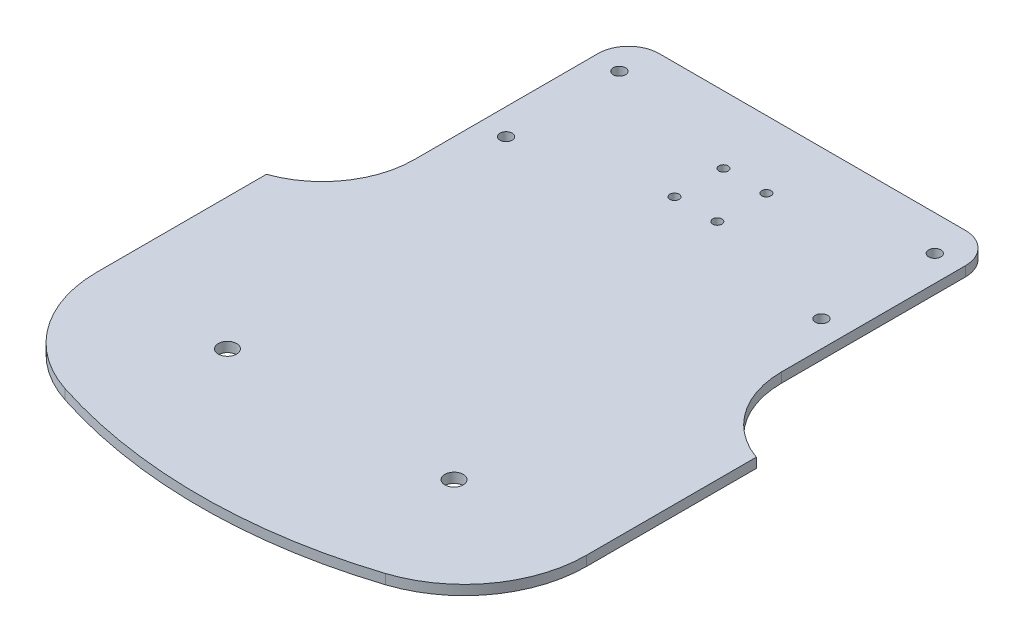
from build123d import *

# Parameters (mm, degrees)
P_IDAT_VYSUNUT_M1_DEPTH  = 0.8
SKICA2_R                 = 1
ODEBRAT_VYSUNUT_M1_DEPTH = 94.955095657
SKICA3_R                 = 0.75
ODEBRAT_VYSUNUT_M2_DEPTH = 94.955095657
SKICA8_R                 = 1.5
ODEBRAT_VYSUNUT_M4_DEPTH = 94.955095657


with BuildPart() as part:
    # Skica1 → Přidat vysunutím1 (new, symmetric)
    with BuildSketch(Plane(origin=(0, 0, 0), x_dir=(1, 0, 0), z_dir=(0, 1, 0))):
        with BuildLine():
            Line((-25, 15), (25, 15))
            ThreePointArc((25, 15), (28.535533906, 13.535533906), (30, 10))
            Line((30, 10), (30, -20))
            ThreePointArc((30, -20), (32.752551286, -28.660254038), (40, -34.142135624))
            Line((40, -34.142135624), (40, -61.846584384))
            ThreePointArc((40, -61.846584384), (36.172150801, -73.613552493), (26.153846154, -80.876302656))
            ThreePointArc((26.153846154, -80.876302656), (0, -85), (-26.153846154, -80.876302656))
            ThreePointArc((-26.153846154, -80.876302656), (-36.172150801, -73.613552493), (-40, -61.846584384))
            Line((-40, -61.846584384), (-40, -34.142135624))
            ThreePointArc((-40, -34.142135624), (-32.752551286, -28.660254038), (-30, -20))
            Line((-30, -20), (-30, 10))
            ThreePointArc((-30, 10), (-28.535533906, 13.535533906), (-25, 15))
        make_face()
    extrude(amount=P_IDAT_VYSUNUT_M1_DEPTH, both=True)

    # Skica2 → Odebrat vysunutím1 (cut, through all)
    with BuildSketch(Plane.XZ.offset(0.8)):
        with Locations(Location((-25.75, -9.25, 0), (0, 0, 270))):
            Circle(SKICA2_R)
        with Locations(Location((-25.75, 9.25, 0), (0, 0, 270))):
            Circle(SKICA2_R)
        with Locations(Location((25.75, 9.25, 0), (0, 0, 270))):
            Circle(SKICA2_R)
        with Locations(Location((25.75, -9.25, 0), (0, 0, 270))):
            Circle(SKICA2_R)
    extrude(amount=-ODEBRAT_VYSUNUT_M1_DEPTH, mode=Mode.SUBTRACT)

    # Skica3 → Odebrat vysunutím2 (cut, through all)
    with BuildSketch(Plane.XZ.offset(0.8)):
        with Locations(Location((-3.5, 4, 0), (0, 0, 270))):
            Circle(SKICA3_R)
        with Locations(Location((3.5, 4, 0), (0, 0, 270))):
            Circle(SKICA3_R)
        with Locations(Location((-3.5, -4, 0), (0, 0, 270))):
            Circle(SKICA3_R)
        with Locations(Location((3.5, -4, 0), (0, 0, 270))):
            Circle(SKICA3_R)
    extrude(amount=-ODEBRAT_VYSUNUT_M2_DEPTH, mode=Mode.SUBTRACT)

    # Skica8 → Odebrat vysunutím4 (cut, through all)
    with BuildSketch(Plane.XZ.offset(0.8)):
        with Locations(Location((18.5, 62, 0), (0, 0, 270))):
            Circle(SKICA8_R)
        with Locations(Location((-18.5, 62, 0), (0, 0, 270))):
            Circle(SKICA8_R)
    extrude(amount=-ODEBRAT_VYSUNUT_M4_DEPTH, mode=Mode.SUBTRACT)


solid = part.part
